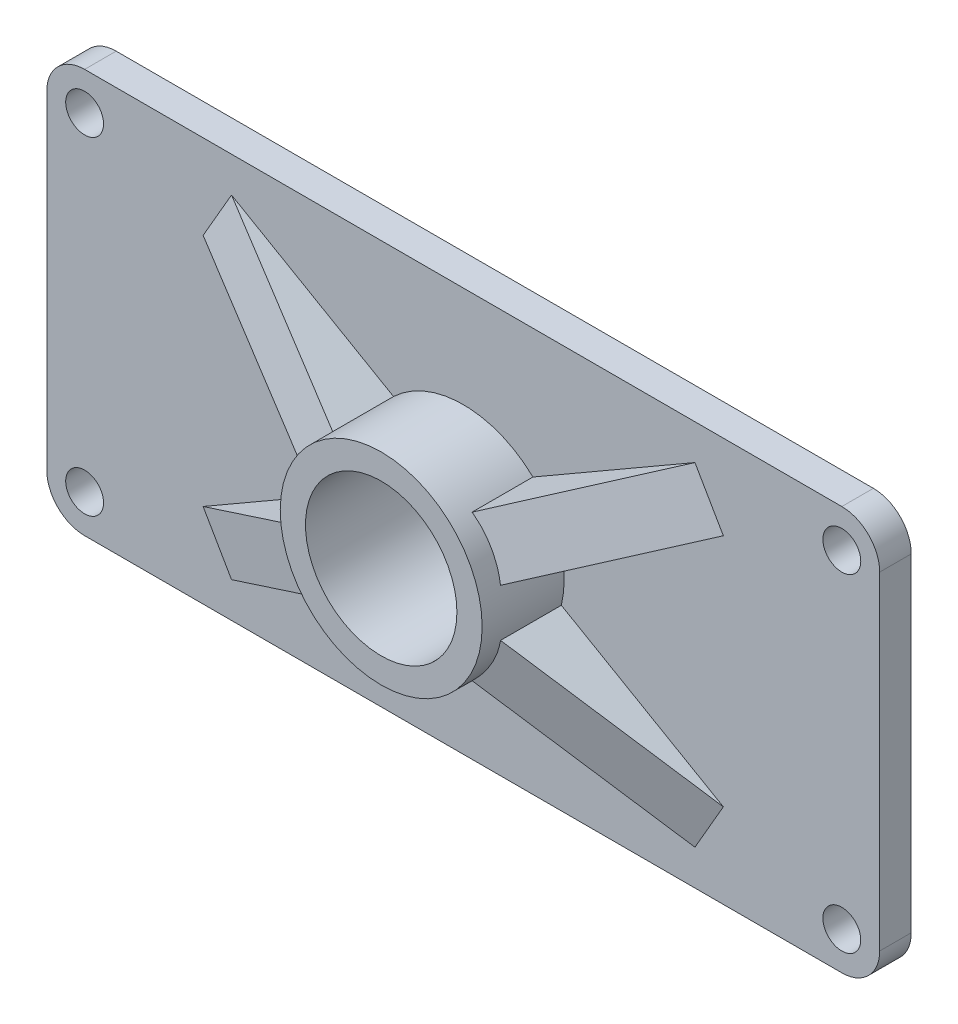
from build123d import *

# Parameters (mm, degrees)
SKETCH3_R               = 3
SKETCH3_R_2             = 16
BASE_PLATE_DEPTH        = 5
SKETCH3_3_R             = 16
SKETCH3_3_R_2           = 12
MIDDLE_BUMP_DEPTH       = 18
RIB3_REACH              = 77.525
SKETCH4_WALL_W          = 183.54206521
SKETCH4_WALL_H          = 9
MIRROR5_COPY_1_REACH    = 77.525
MIRROR5_COPY_1_SKETCH_W = 183.54206521
MIRROR5_COPY_1_SKETCH_H = 9
MIRROR5_COPY_2_REACH    = 77.525
MIRROR5_COPY_2_SKETCH_W = 183.54206521
MIRROR5_COPY_2_SKETCH_H = 9


with BuildPart() as part:
    # Sketch3 → Base PLate (new body)
    with BuildSketch(Plane.XY):
        with BuildLine():
            Line((60, 32), (-60, 32))
            ThreePointArc((-60, 32), (-64.242640687, 30.242640687), (-66, 26))
            Line((-66, 26), (-66, -26))
            ThreePointArc((-66, -26), (-64.242640687, -30.242640687), (-60, -32))
            Line((-60, -32), (60, -32))
            ThreePointArc((60, -32), (64.242640687, -30.242640687), (66, -26))
            Line((66, -26), (66, 26))
            ThreePointArc((66, 26), (64.242640687, 30.242640687), (60, 32))
        make_face()
        with Locations((-60, -26)):
            Circle(SKETCH3_R, mode=Mode.SUBTRACT)
        with Locations((60, -26)):
            Circle(SKETCH3_R, mode=Mode.SUBTRACT)
        Circle(SKETCH3_R_2, mode=Mode.SUBTRACT)
        with Locations((-60, 26)):
            Circle(SKETCH3_R, mode=Mode.SUBTRACT)
        with Locations((60, 26)):
            Circle(SKETCH3_R, mode=Mode.SUBTRACT)
    extrude(amount=BASE_PLATE_DEPTH)

    # Sketch3<3> → Middle Bump (add)
    with BuildSketch(Plane.XY):
        Circle(SKETCH3_3_R)
        Circle(SKETCH3_3_R_2, mode=Mode.SUBTRACT)
    extrude(amount=MIDDLE_BUMP_DEPTH)

    # Sketch4 wall → Rib3 (add, up to next)
    with BuildSketch(Plane(origin=(-26.413774815, -15.25, 9.711335595), x_dir=(-0.823639103536, -0.475528258156, -0.309016994388), z_dir=(-0.267616567342, -0.154508497194, 0.951056516291)), mode=Mode.PRIVATE) as rib3_sk1:
        Rectangle(SKETCH4_WALL_W, SKETCH4_WALL_H)
    rib3_tool1 = extrude(rib3_sk1.sketch, amount=-RIB3_REACH, mode=Mode.PRIVATE) - part.part
    rib3 = rib3_tool1.solids().sort_by_distance((-26.413774815, -15.25, 9.711335595))[0]
    add(rib3)

    # Mirror4: Rib3 across plane
    add(rib3.mirror(Plane(origin=(0, 0, 0), x_dir=(0, 0, 1), z_dir=(1, 0, 0))))

    # Mirror5 copy 1 sketch → Mirror5 copy 1 (add, up to next)
    with BuildSketch(Plane(origin=(26.413774815, 15.25, 9.711335595), x_dir=(0.823639103536, 0.475528258156, -0.309016994388), z_dir=(0.267616567342, 0.154508497194, 0.951056516291)), mode=Mode.PRIVATE) as mirror5_copy_1_sk1:
        Rectangle(MIRROR5_COPY_1_SKETCH_W, MIRROR5_COPY_1_SKETCH_H)
    mirror5_copy_1_tool1 = extrude(mirror5_copy_1_sk1.sketch, amount=-MIRROR5_COPY_1_REACH, mode=Mode.PRIVATE) - part.part
    add(mirror5_copy_1_tool1.solids().sort_by_distance((26.413774815, 15.25, 9.711335595))[0])

    # Mirror5 copy 2 sketch → Mirror5 copy 2 (add, up to next)
    with BuildSketch(Plane(origin=(-26.413774815, 15.25, 9.711335595), x_dir=(-0.823639103536, 0.475528258156, -0.309016994388), z_dir=(-0.267616567342, 0.154508497194, 0.951056516291)), mode=Mode.PRIVATE) as mirror5_copy_2_sk1:
        Rectangle(MIRROR5_COPY_2_SKETCH_W, MIRROR5_COPY_2_SKETCH_H)
    mirror5_copy_2_tool1 = extrude(mirror5_copy_2_sk1.sketch, amount=-MIRROR5_COPY_2_REACH, mode=Mode.PRIVATE) - part.part
    add(mirror5_copy_2_tool1.solids().sort_by_distance((-26.413774815, 15.25, 9.711335595))[0])


solid = part.part
